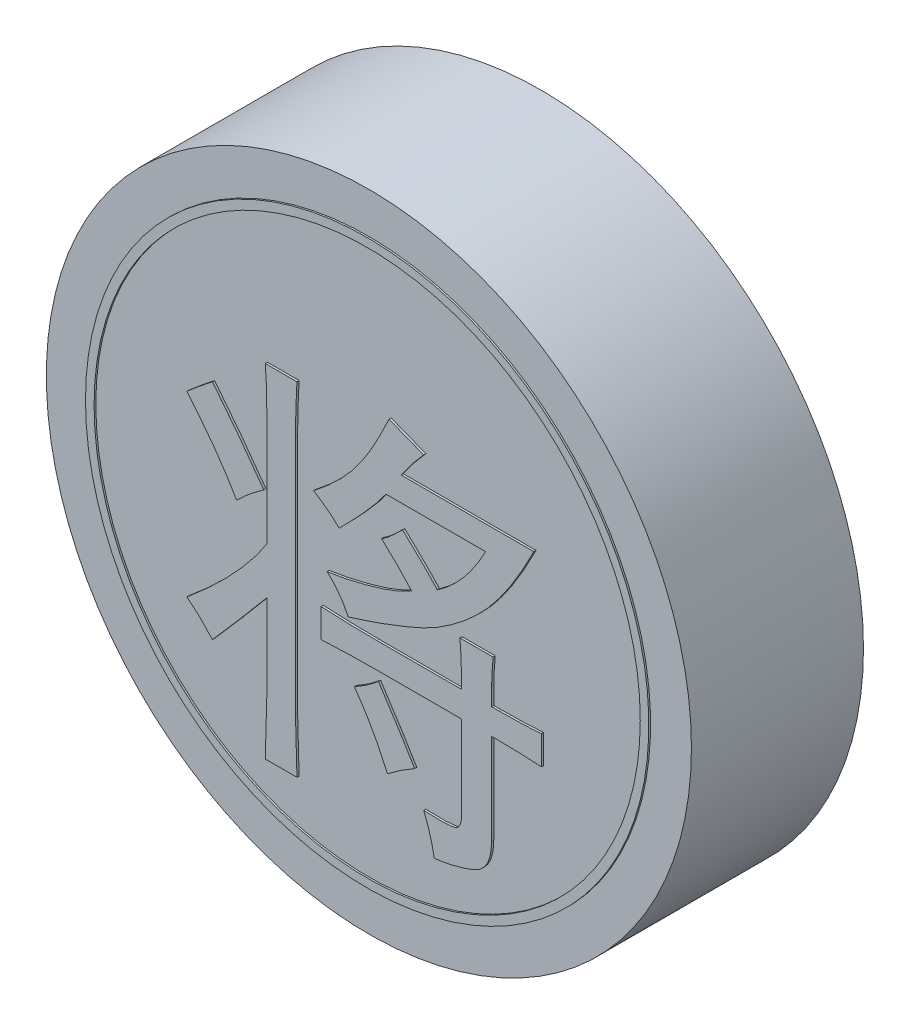
from build123d import *

# Parameters (mm, degrees)
SKETCH_1_R               = 15
DIAMETER30_HEIGHT8_DEPTH = 8
CHARACTER_DEPTH          = 0.1
SKETCH_3_R               = 13.1
SKETCH_3_R_2             = 12.7
INK_RING_DEPTH           = 0.08


with BuildPart() as part:
    # 草图1 → Diameter30_Height8 (new body)
    with BuildSketch(Plane.XY):
        Circle(SKETCH_1_R)
    extrude(amount=-DIAMETER30_HEIGHT8_DEPTH)

    # 草图2 → Character_将 (add)
    with BuildSketch(Plane.XY):
        with BuildLine():
            add(Edge.make_bspline(
                [(2.649122807, 5.675438596), (2.547995251, 5.560756708), (2.350386158, 5.336661664), (2.072088619, 4.999996886), (1.82216465, 4.669957417), (1.670222599, 4.449220176), (1.596491228, 4.342105263)],
                knots=[0, 0, 0, 0, 1.079161469, 2.108743928, 3.08224943, 4, 4, 4, 4], degree=3))
            Line((1.596491228, 4.342105263), (7.771929825, 4.342105263))
            add(Edge.make_bspline(
                [(7.771929825, 4.342105263), (7.667293114, 4.137951126), (7.462897396, 3.739159623), (7.14650433, 3.165780002), (6.830319772, 2.631431553), (6.509334526, 2.138740654), (6.187952882, 1.684181362), (5.866518034, 1.267837973), (5.544066977, 0.891001401), (5.114912302, 0.451463673), (4.575373631, -0.039323123), (3.911001462, -0.553369879), (3.238867264, -0.992218958), (2.540150828, -1.354562345), (1.794560835, -1.669402354), (0.986464371, -1.988789786), (0.091866991, -2.300206116), (-0.534313385, -2.500960186), (-0.859649123, -2.605263158)],
                knots=[0, 0, 0, 0, 0.956461889, 1.868337722, 2.730067817, 3.544633787, 4.319388845, 5.05060464, 5.737050918, 6.385914423, 7.610816521, 8.774810077, 9.884977967, 10.952971927, 12.051495524, 13.258260257, 14.57551281, 16, 16, 16, 16], degree=3))
            add(Edge.make_bspline(
                [(-0.859649123, -2.605263158), (-0.921076882, -2.479868395), (-1.043665257, -2.2296242), (-1.274908543, -1.88231672), (-1.537540367, -1.557773281), (-1.740146746, -1.367621007), (-1.842105263, -1.271929825)],
                knots=[0, 0, 0, 0, 1.00365356, 2.002942333, 2.995011704, 4, 4, 4, 4], degree=3))
            add(Edge.make_bspline(
                [(-1.842105263, -1.271929825), (-1.675538979, -1.246374258), (-1.334292248, -1.194018203), (-0.817047115, -1.088944947), (-0.281868941, -0.962437589), (0.26066697, -0.822709346), (0.785261702, -0.659231778), (1.270303533, -0.485149549), (1.701410748, -0.29397459), (1.963035545, -0.14834889), (2.087719298, -0.078947368)],
                knots=[0, 0, 0, 0, 0.979493574, 2.006702509, 3.067069232, 4.176257781, 5.262653342, 6.260045427, 7.170781712, 8, 8, 8, 8], degree=3))
            add(Edge.make_bspline(
                [(2.087719298, -0.078947368), (1.86881131, 0.157847942), (1.419350477, 0.644034938), (0.933453464, 1.093834703), (0.684210526, 1.324561404)],
                knots=[0, 0, 0, 0, 0.9740915, 2, 2, 2, 2], degree=3))
            add(Edge.make_bspline(
                [(0.684210526, 1.324561404), (0.710565367, 1.338712046), (0.768728724, 1.369941559), (0.8562959, 1.435673371), (0.960989273, 1.512375064), (1.077300152, 1.60862876), (1.20485704, 1.724784176), (1.346913264, 1.856517261), (1.503626832, 2.004770556), (1.610586189, 2.110979593), (1.666666667, 2.166666667)],
                knots=[0, 0, 0, 0, 0.552596433, 1.21954308, 2.020828341, 2.954454623, 4.009841916, 5.21187664, 6.538142936, 8, 8, 8, 8], degree=3))
            add(Edge.make_bspline(
                [(1.666666667, 2.166666667), (1.762088582, 2.076694304), (1.945781391, 1.903492207), (2.207761274, 1.652569932), (2.444121991, 1.419311081), (2.660802857, 1.21064161), (2.849941343, 1.018500147), (3.014552693, 0.845260055), (3.157352305, 0.694175397), (3.241984657, 0.59705955), (3.280701754, 0.552631579)],
                knots=[0, 0, 0, 0, 1.378471289, 2.653638435, 3.812716353, 4.868778462, 5.815322237, 6.646168057, 7.380657144, 8, 8, 8, 8], degree=3))
            add(Edge.make_bspline(
                [(3.280701754, 0.552631579), (3.391202618, 0.631480441), (3.613289383, 0.789952403), (3.925066626, 1.061581392), (4.227212607, 1.354774561), (4.515811142, 1.674868514), (4.790052671, 2.022264561), (5.04755707, 2.397774585), (5.300674154, 2.794713982), (5.450227675, 3.076125129), (5.526315789, 3.219298246)],
                knots=[0, 0, 0, 0, 0.924716273, 1.858512587, 2.814741213, 3.793048226, 4.793625974, 5.828834084, 6.895379252, 8, 8, 8, 8], degree=3))
            Line((5.526315789, 3.219298246), (0.894736842, 3.219298246))
            add(Edge.make_bspline(
                [(0.894736842, 3.219298246), (0.83815544, 3.13915603), (0.718899079, 2.970240651), (0.517872436, 2.712555071), (0.284245547, 2.438580125), (0.028819729, 2.1389746), (-0.257841465, 1.822404833), (-0.573265384, 1.487064304), (-0.916268812, 1.130854683), (-1.156498533, 0.888473475), (-1.280701754, 0.763157895)],
                knots=[0, 0, 0, 0, 0.716714086, 1.510614975, 2.386739176, 3.347269716, 4.387082353, 5.506647018, 6.710890262, 8, 8, 8, 8], degree=3))
            add(Edge.make_bspline(
                [(-1.280701754, 0.763157895), (-1.366268731, 0.844926758), (-1.540008164, 1.010954314), (-1.826521144, 1.242692633), (-2.138185293, 1.466482593), (-2.360232461, 1.604778386), (-2.473684211, 1.675438596)],
                knots=[0, 0, 0, 0, 0.943180642, 1.915080753, 2.934741037, 4, 4, 4, 4], degree=3))
            add(Edge.make_bspline(
                [(-2.473684211, 1.675438596), (-2.272414736, 1.836812452), (-1.882629089, 2.149334821), (-1.349168985, 2.642060255), (-0.878699224, 3.132161086), (-0.534402525, 3.552870114), (-0.285762925, 3.901948228), (-0.098629156, 4.179634678), (0.090025045, 4.479618404), (0.274039184, 4.80436189), (0.466182213, 5.147479353), (0.653863844, 5.514727625), (0.847964968, 5.901647032), (0.971732223, 6.169768333), (1.035087719, 6.307017544)],
                knots=[0, 0, 0, 0, 1.578922043, 3.057796785, 4.442105242, 5.735171578, 6.381329358, 7.06536331, 7.784990334, 8.550089925, 9.350129919, 10.192259238, 11.074631549, 12, 12, 12, 12], degree=3))
            add(Edge.make_bspline(
                [(1.035087719, 6.307017544), (1.125250521, 6.273390025), (1.299686952, 6.208331438), (1.550472821, 6.111824655), (1.782523727, 6.024473215), (1.993085056, 5.940034543), (2.184825827, 5.865357958), (2.357475637, 5.79753416), (2.510353639, 5.736054569), (2.605023832, 5.694701537), (2.649122807, 5.675438596)],
                knots=[0, 0, 0, 0, 1.33238246, 2.57773759, 3.720603536, 4.765328367, 5.71873806, 6.569669246, 7.333727776, 8, 8, 8, 8], degree=3))
        make_face()
        with BuildLine():
            Line((4.403508772, -2.885964912), (4.403508772, -2.254385965))
            add(Edge.make_bspline(
                [(4.403508772, -2.254385965), (4.40224465, -2.15474185), (4.399572645, -1.9441217), (4.385382124, -1.61054798), (4.365582936, -1.242167427), (4.344397253, -0.985117725), (4.333333333, -0.850877193)],
                knots=[0, 0, 0, 0, 0.85071404, 1.798174621, 2.850128174, 4, 4, 4, 4], degree=3))
            Line((4.333333333, -0.850877193), (5.877192982, -0.850877193))
            add(Edge.make_bspline(
                [(5.877192982, -0.850877193), (5.866199728, -0.972122237), (5.845563067, -1.199724799), (5.825418735, -1.520436791), (5.811312242, -1.796827769), (5.808358273, -1.966740639), (5.807017544, -2.043859649)],
                knots=[0, 0, 0, 0, 1.222087738, 2.294116862, 3.22574423, 4, 4, 4, 4], degree=3))
            Line((5.807017544, -2.043859649), (5.807017544, -2.885964912))
            Line((5.807017544, -2.885964912), (6.157894737, -2.885964912))
            add(Edge.make_bspline(
                [(6.157894737, -2.885964912), (6.330311021, -2.884831378), (6.669992765, -2.882598173), (7.169931961, -2.86903792), (7.652726223, -2.849819878), (7.9677758, -2.827012598), (8.122807018, -2.815789474)],
                knots=[0, 0, 0, 0, 1.0520594, 2.072689219, 3.051598987, 4, 4, 4, 4], degree=3))
            Line((8.122807018, -2.815789474), (8.122807018, -4.149122807))
            add(Edge.make_bspline(
                [(8.122807018, -4.149122807), (7.950439783, -4.137989416), (7.611925986, -4.116124435), (7.111871906, -4.096449339), (6.629272704, -4.082601006), (6.312983039, -4.080149454), (6.157894737, -4.078947368)],
                knots=[0, 0, 0, 0, 1.053977181, 2.069916693, 3.053610102, 4, 4, 4, 4], degree=3))
            Line((6.157894737, -4.078947368), (5.807017544, -4.078947368))
            Line((5.807017544, -4.078947368), (5.807017544, -8.289473684))
            add(Edge.make_bspline(
                [(5.807017544, -8.289473684), (5.804617944, -8.384908574), (5.800039465, -8.566999965), (5.763003431, -8.827475832), (5.704853654, -9.061790404), (5.621876352, -9.271155946), (5.511544303, -9.452685232), (5.377367913, -9.608351051), (5.218855699, -9.739017365), (4.968170287, -9.872303884), (4.617524481, -10.002095619), (4.165997239, -10.14171234), (3.668495948, -10.250361894), (3.320935844, -10.299190882), (3.140350877, -10.324561404)],
                knots=[0, 0, 0, 0, 0.904848947, 1.726467161, 2.489802636, 3.190213738, 3.853995735, 4.494848733, 5.13141999, 5.789890829, 7.176979744, 8.671668547, 10.270668525, 12, 12, 12, 12], degree=3))
            add(Edge.make_bspline(
                [(3.140350877, -10.324561404), (3.114315887, -10.183849573), (3.061895001, -9.90052937), (2.951534094, -9.478605317), (2.813479402, -9.057436755), (2.704227026, -8.780188232), (2.649122807, -8.640350877)],
                knots=[0, 0, 0, 0, 0.976532204, 1.966226292, 2.974214425, 4, 4, 4, 4], degree=3))
            add(Edge.make_bspline(
                [(2.649122807, -8.640350877), (2.760008996, -8.644813259), (2.967881434, -8.65317865), (3.260714513, -8.6630198), (3.515616254, -8.660335732), (3.732319603, -8.650151333), (3.91120767, -8.635662095), (4.052065285, -8.614811078), (4.155685995, -8.583483186), (4.244428293, -8.530146804), (4.310169464, -8.436952085), (4.364681951, -8.312867261), (4.399202709, -8.167354981), (4.402021496, -8.063545106), (4.403508772, -8.00877193)],
                knots=[0, 0, 0, 0, 1.84270246, 3.454416252, 4.864233575, 6.073954754, 7.055944869, 7.843457503, 8.43482508, 8.84195256, 9.538407401, 10.278927917, 11.091911197, 12, 12, 12, 12], degree=3))
            Line((4.403508772, -8.00877193), (4.403508772, -4.078947368))
            Line((4.403508772, -4.078947368), (0.473684211, -4.078947368))
            add(Edge.make_bspline(
                [(0.473684211, -4.078947368), (0.035223709, -4.082048212), (-0.830742979, -4.088172429), (-1.695766466, -4.128978076), (-2.122807018, -4.149122807)],
                knots=[0, 0, 0, 0, 1.012649812, 2, 2, 2, 2], degree=3))
            Line((-2.122807018, -4.149122807), (-2.122807018, -2.815789474))
            add(Edge.make_bspline(
                [(-2.122807018, -2.815789474), (-1.695766466, -2.835934205), (-0.830742979, -2.876739852), (0.035223709, -2.882864069), (0.473684211, -2.885964912)],
                knots=[0, 0, 0, 0, 0.987350188, 2, 2, 2, 2], degree=3))
            Line((0.473684211, -2.885964912), (4.403508772, -2.885964912))
        make_face()
        with BuildLine():
            add(Edge.make_bspline(
                [(-4.649122807, 3.850877193), (-4.650242479, 4.012031888), (-4.652440044, 4.328327841), (-4.666100186, 4.793612351), (-4.685130475, 5.240915624), (-4.708061813, 5.53254112), (-4.719298246, 5.675438596)],
                knots=[0, 0, 0, 0, 1.058831035, 2.078152119, 3.058288058, 4, 4, 4, 4], degree=3))
            Line((-4.719298246, 5.675438596), (-3.245614035, 5.675438596))
            add(Edge.make_bspline(
                [(-3.245614035, 5.675438596), (-3.256754045, 5.479675144), (-3.278681024, 5.09435221), (-3.298318206, 4.524139385), (-3.31215814, 3.97136857), (-3.314592679, 3.608303578), (-3.315789474, 3.429824561)],
                knots=[0, 0, 0, 0, 1.047124439, 2.061064296, 3.046839149, 4, 4, 4, 4], degree=3))
            Line((-3.315789474, 3.429824561), (-3.315789474, -7.728070175))
            add(Edge.make_bspline(
                [(-3.315789474, -7.728070175), (-3.316092605, -7.772259233), (-3.316811968, -7.877124688), (-3.309062957, -8.061588088), (-3.305703414, -8.298163643), (-3.297206883, -8.588384779), (-3.286094854, -8.929683722), (-3.277448581, -9.324850839), (-3.259865465, -9.771778148), (-3.250526384, -10.08803507), (-3.245614035, -10.254385965)],
                knots=[0, 0, 0, 0, 0.419579496, 0.995707933, 1.752775263, 2.666311164, 3.752780118, 4.995500302, 6.419635506, 8, 8, 8, 8], degree=3))
            Line((-3.245614035, -10.254385965), (-4.719298246, -10.254385965))
            add(Edge.make_bspline(
                [(-4.719298246, -10.254385965), (-4.714385897, -10.08803507), (-4.705046816, -9.771778148), (-4.6874637, -9.324850839), (-4.678817427, -8.929683722), (-4.667705397, -8.588384779), (-4.659208867, -8.298163643), (-4.655849323, -8.061588088), (-4.648100312, -7.877124688), (-4.648819676, -7.772259233), (-4.649122807, -7.728070175)],
                knots=[0, 0, 0, 0, 1.580364494, 3.004499698, 4.247219882, 5.333688836, 6.247224737, 7.004292067, 7.580420504, 8, 8, 8, 8], degree=3))
            Line((-4.649122807, -7.728070175), (-4.649122807, -3.728070175))
            add(Edge.make_bspline(
                [(-4.649122807, -3.728070175), (-4.769568631, -3.871002124), (-5.006100052, -4.151691781), (-5.35356813, -4.564765665), (-5.68894934, -4.95974818), (-6.011044255, -5.336786754), (-6.321223268, -5.695565274), (-6.616642122, -6.038538785), (-6.899900808, -6.363471833), (-7.085229085, -6.573302445), (-7.175438596, -6.675438596)],
                knots=[0, 0, 0, 0, 1.155566342, 2.269300341, 3.337112721, 4.359017331, 5.335029974, 6.269215869, 7.157531738, 8, 8, 8, 8], degree=3))
            add(Edge.make_bspline(
                [(-7.175438596, -6.675438596), (-7.287276066, -6.555121596), (-7.498805657, -6.327553804), (-7.80833224, -6.018845957), (-8.092563746, -5.761962778), (-8.28086151, -5.619075148), (-8.368421053, -5.552631579)],
                knots=[0, 0, 0, 0, 1.201217936, 2.271985754, 3.196463447, 4, 4, 4, 4], degree=3))
            add(Edge.make_bspline(
                [(-8.368421053, -5.552631579), (-8.163675327, -5.379811495), (-7.763006933, -5.041618621), (-7.194884126, -4.523507307), (-6.665328954, -4.014663769), (-6.179744484, -3.510252165), (-5.733901533, -3.015083659), (-5.332890918, -2.524074368), (-4.968604248, -2.042479693), (-4.753900542, -1.713283089), (-4.649122807, -1.552631579)],
                knots=[0, 0, 0, 0, 1.172627158, 2.294722579, 3.364754358, 4.386529231, 5.358665931, 6.280215446, 7.160726502, 8, 8, 8, 8], degree=3))
            Line((-4.649122807, -1.552631579), (-4.649122807, 3.850877193))
        make_face()
        with BuildLine():
            add(Edge.make_bspline(
                [(-7.175438596, 3.710526316), (-6.949470213, 3.426055069), (-6.511385068, 2.87455036), (-5.886577545, 2.064045419), (-5.317733876, 1.295331793), (-4.961154243, 0.79400352), (-4.789473684, 0.552631579)],
                knots=[0, 0, 0, 0, 1.101296642, 2.13508497, 3.102108969, 4, 4, 4, 4], degree=3))
            add(Edge.make_bspline(
                [(-4.789473684, 0.552631579), (-4.904851921, 0.47079712), (-5.13283793, 0.309093213), (-5.454330988, 0.045185684), (-5.764772162, -0.218787075), (-5.957484743, -0.407050044), (-6.052631579, -0.5)],
                knots=[0, 0, 0, 0, 1.030766017, 2.036781269, 3.030711695, 4, 4, 4, 4], degree=3))
            add(Edge.make_bspline(
                [(-6.052631579, -0.5), (-6.120204141, -0.379932032), (-6.258767697, -0.133721971), (-6.489714365, 0.23658721), (-6.74460987, 0.619245955), (-7.01898538, 1.018234835), (-7.322641791, 1.426687506), (-7.649854841, 1.848416606), (-7.997626051, 2.286997817), (-8.242928332, 2.578792623), (-8.368421053, 2.728070175)],
                knots=[0, 0, 0, 0, 0.830940233, 1.703916959, 2.6314913, 3.604145779, 4.624214172, 5.700807236, 6.823769784, 8, 8, 8, 8], degree=3))
            add(Edge.make_bspline(
                [(-8.368421053, 2.728070175), (-8.17632244, 2.893148468), (-7.785531234, 3.228971535), (-7.381077646, 3.548212494), (-7.175438596, 3.710526316)],
                knots=[0, 0, 0, 0, 0.98312659, 2, 2, 2, 2], degree=3))
        make_face()
        with BuildLine():
            add(Edge.make_bspline(
                [(0.543859649, -4.5), (0.639987888, -4.64730524), (0.824761144, -4.930448558), (1.092103478, -5.33880977), (1.331508976, -5.719995519), (1.558016339, -6.065613817), (1.752208101, -6.387297693), (1.934249012, -6.672170946), (2.089575344, -6.929049009), (2.184074382, -7.091182425), (2.228070175, -7.166666667)],
                knots=[0, 0, 0, 0, 1.338333826, 2.572483377, 3.7135535, 4.763123252, 5.716205277, 6.572152244, 7.33523879, 8, 8, 8, 8], degree=3))
            add(Edge.make_bspline(
                [(2.228070175, -7.166666667), (2.014893834, -7.290904276), (1.57691346, -7.546156027), (1.172491595, -7.851861298), (0.964912281, -8.00877193)],
                knots=[0, 0, 0, 0, 0.973451572, 2, 2, 2, 2], degree=3))
            add(Edge.make_bspline(
                [(0.964912281, -8.00877193), (0.85679125, -7.766584267), (0.641210895, -7.283691144), (0.269907843, -6.586463991), (-0.131220406, -5.911863932), (-0.429849414, -5.485034852), (-0.578947368, -5.271929825)],
                knots=[0, 0, 0, 0, 1.010640663, 2.01509614, 3.008987412, 4, 4, 4, 4], degree=3))
            add(Edge.make_bspline(
                [(-0.578947368, -5.271929825), (-0.476099585, -5.213174383), (-0.272663583, -5.096954357), (0.016998287, -4.907628062), (0.289138196, -4.709430299), (0.459606879, -4.569272072), (0.543859649, -4.5)],
                knots=[0, 0, 0, 0, 1.041332516, 2.059786956, 3.041065375, 4, 4, 4, 4], degree=3))
        make_face()
    extrude(amount=CHARACTER_DEPTH)

    # 草图3 → Ink_ring (add)
    with BuildSketch(Plane.XY):
        with Locations(Location((0, 0, 0), (0, 0, 180))):
            Circle(SKETCH_3_R)
        with Locations(Location((0, 0, 0), (0, 0, 180))):
            Circle(SKETCH_3_R_2, mode=Mode.SUBTRACT)
    extrude(amount=INK_RING_DEPTH)


solid = part.part
